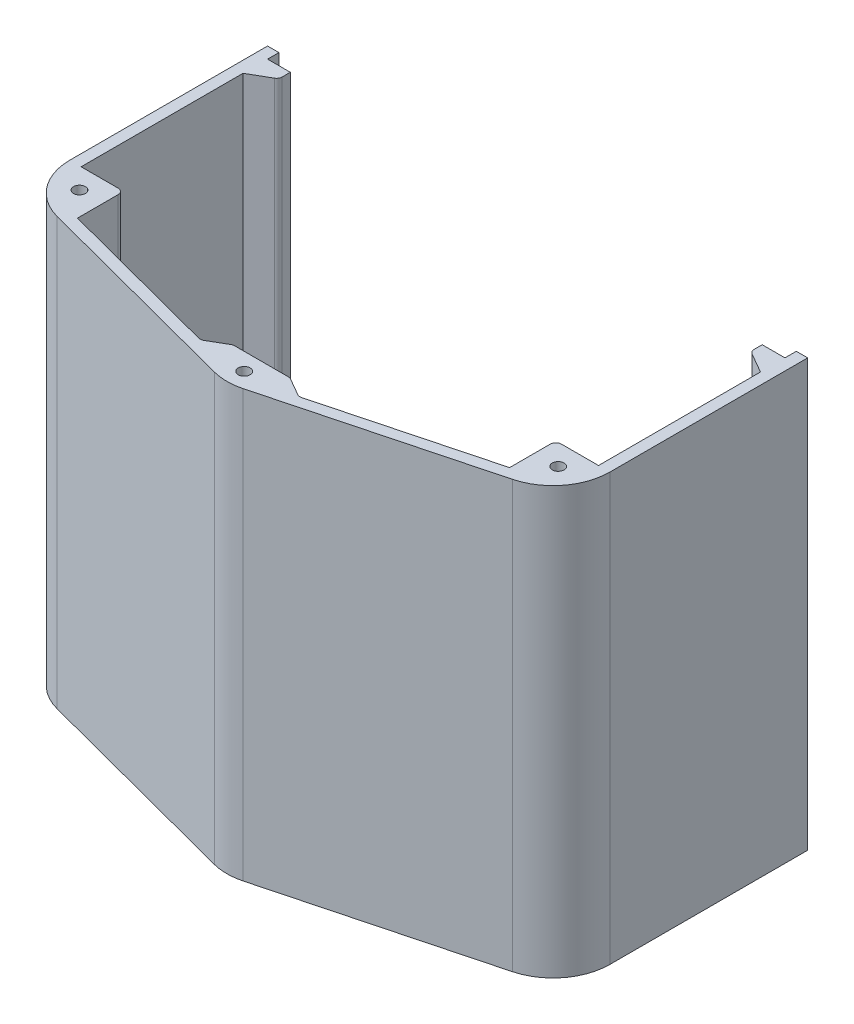
from build123d import *

# Parameters (mm, degrees)
BOSS_EXTRUDE1_DEPTH = 150
SHELL2_T            = -4
BOSS_EXTRUDE2_DEPTH = 150
FILLET1_R           = 2
SKETCH4_R           = 2.1
CUT_EXTRUDE1_DEPTH  = 150
SKETCH5_W           = 166
SKETCH5_H           = 2.845299462
BOSS_EXTRUDE3_DEPTH = 10
BOSS_EXTRUDE6_DEPTH = 150
FILLET2_R           = 2
SKETCH7_R           = 2.1
CUT_EXTRUDE3_DEPTH  = 150


with BuildPart() as part:
    # Sketch1 → Boss-Extrude1 (new body)
    with BuildSketch(Plane(origin=(0, 0, 0), x_dir=(1, 0, 0), z_dir=(0, 1, 0))):
        with BuildLine():
            Line((95, 0), (95, -69.582228732))
            ThreePointArc((95, -69.582228732), (90.839780928, -81.792934696), (80.089865986, -88.923719477))
            Line((80.089865986, -88.923719477), (5.089865986, -108.660561583))
            ThreePointArc((5.089865986, -108.660561583), (0, -109.319070837), (-5.089865986, -108.660561583))
            Line((-5.089865986, -108.660561583), (-80.089865986, -88.923719477))
            ThreePointArc((-80.089865986, -88.923719477), (-90.839780928, -81.792934696), (-95, -69.582228732))
            Line((-95, -69.582228732), (-95, 0))
            Line((-95, 0), (95, 0))
        make_face()
    extrude(amount=BOSS_EXTRUDE1_DEPTH)

    # Shell2
    shell2_openings = [part.faces().sort_by_distance(p)[0] for p in [
        (0, 150, 48.84344893),
        (0, 75, 0),
        (0, 0, 48.84344893),
    ]]
    offset(amount=SHELL2_T, openings=shell2_openings, kind=Kind.INTERSECTION)

    # Sketch3 → Boss-Extrude2 (add)
    with BuildSketch(Plane(origin=(0, 0, 0), x_dir=(1, 0, 0), z_dir=(0, 1, 0))):
        Polygon((-91, -4), (-83, -4), (-83, -8), (-91, -12.618802154), align=None)
        Polygon((-91, -69.582228732), (-76, -69.582228732), (-76, -85.863814167), (-80.300337087, -88.867104329), (-90.839780928, -81.792934696), (-95, -69.582228732), align=None)
        Polygon((91, -69.582228732), (76, -69.582228732), (76, -85.863814167), (80.300337087, -88.867104329), (90.839780928, -81.792934696), (95, -69.582228732), align=None)
        Polygon((83, -8), (91, -12.618802154), (91, -4), (83, -4), align=None)
    extrude(amount=BOSS_EXTRUDE2_DEPTH)

    # Fillet1
    fillet1_edges = [part.edges().sort_by_distance(p)[0] for p in [
        (83, 75, 8),
        (76, 75, 69.582228732),
        (-76, 75, 69.582228732),
        (-83, 75, 8),
    ]]
    fillet(fillet1_edges, radius=FILLET1_R)

    # Sketch4 → Cut-Extrude1 (cut)
    with BuildSketch(Plane(origin=(0, 0, 0), x_dir=(1, 0, 0), z_dir=(0, 1, 0))):
        with Locations(Location((84.197294702, -76.966150565, 0), (0, 0, 270))):
            Circle(SKETCH4_R)
        with Locations(Location((-84.197294702, -76.966150565, 0), (0, 0, 270))):
            Circle(SKETCH4_R)
    extrude(amount=CUT_EXTRUDE1_DEPTH, mode=Mode.SUBTRACT)

    # Sketch5 → Boss-Extrude3 (add)
    with BuildSketch(Plane(origin=(0, 0, 0), x_dir=(1, 0, 0), z_dir=(0, 1, 0))):
        with Locations((0, -5.422649731)):
            Rectangle(SKETCH5_W, SKETCH5_H)
    extrude(amount=BOSS_EXTRUDE3_DEPTH)

    # Sketch6 → Boss-Extrude6 (add)
    with BuildSketch(Plane(origin=(0, 0, 0), x_dir=(1, 0, 0), z_dir=(0, 1, 0))):
        Polygon((10, -97.119070837), (17.273176686, -101.318241355), (0, -107.972122026), (-17.273176686, -101.318241355), (-10, -97.119070837), align=None)
    extrude(amount=BOSS_EXTRUDE6_DEPTH)

    # Fillet2
    fillet2_edges = [part.edges().sort_by_distance(p)[0] for p in [
        (10, 75, 97.119070837),
        (-10, 75, 97.119070837),
        (-17.273176686, 75, 101.318241355),
        (17.273176686, 75, 101.318241355),
    ]]
    fillet(fillet2_edges, radius=FILLET2_R)

    # Sketch7 → Cut-Extrude3 (cut)
    with BuildSketch(Plane(origin=(0, 0, 0), x_dir=(1, 0, 0), z_dir=(0, 1, 0))):
        with Locations(Location((0, -103.219070837, 0), (0, 0, 270))):
            Circle(SKETCH7_R)
    extrude(amount=CUT_EXTRUDE3_DEPTH, mode=Mode.SUBTRACT)


solid = part.part
